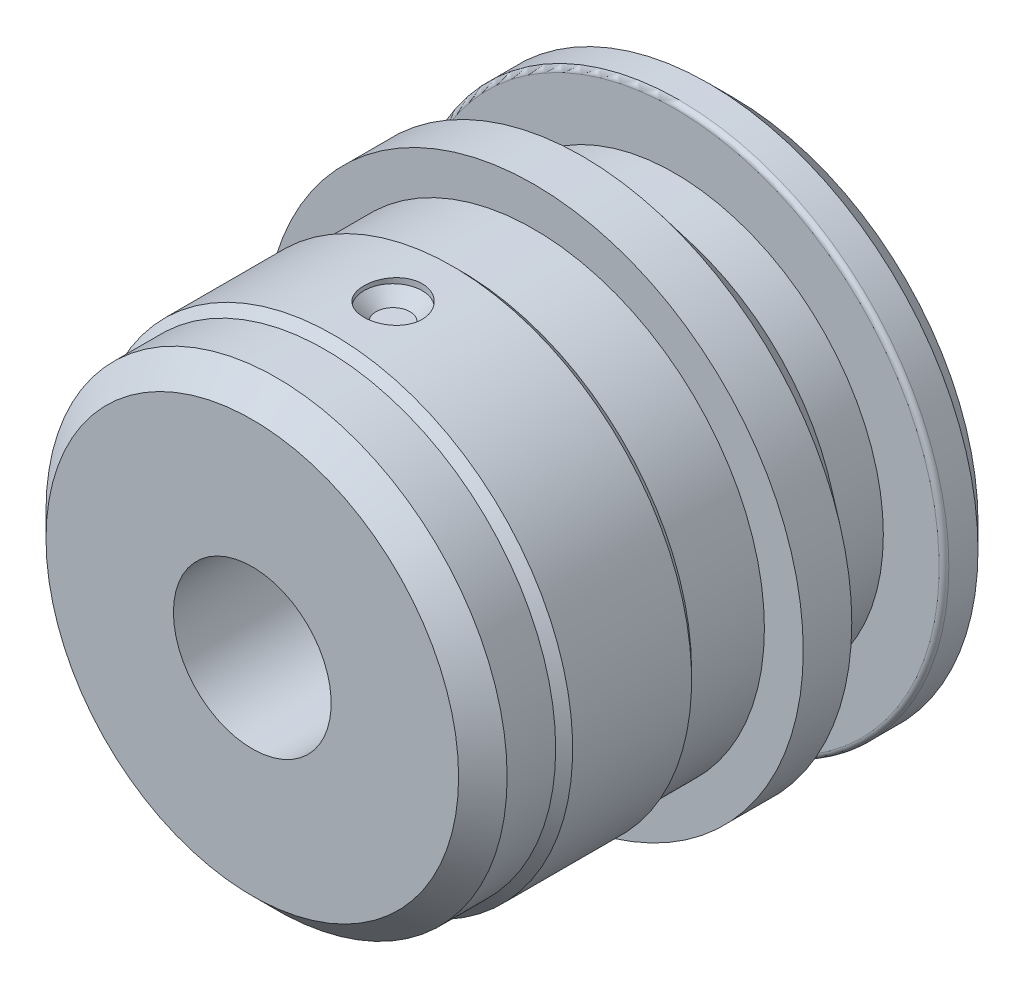
from build123d import *

# Parameters (mm, degrees)
CHAMFER_1_SIZE                       = 1
CHAMFER_2_SIZE                       = 1
FILLET_1_R                           = 0.2
SKETCH_5_R                           = 1.2
CUT_EXTRUDE_2_DEPTH                  = 2
CHAMFER_3_SIZE                       = 0.5
PATTERN_CIRCULAR_1_COUNT             = 2
CHAMFER_3_OF_PATTERN_CIRCULAR_1_SIZE = 0.5


with BuildPart() as part:
    # 스케치3 → 회전2 (revolve)
    with BuildSketch(Plane(origin=(0, 0, 0), x_dir=(1, 0, 0), z_dir=(0, 1, 0)), mode=Mode.PRIVATE) as revolve_2_sk:
        Polygon((11.1, 0), (11.1, -2.4), (8.6, -2.4), (8.6, -4.2), (11.1, -6.2), (11.1, -8.2), (9.5, -8.2), (9.5, -11.2), (9.85, -11.55), (9.85, -16.45), (9.5, -16.8), (9.5, -19.8), (3.25, -19.8), (3.25, -11.8), (4.4, -11.8), (4.4, -10), (3.4, -10), (3.4, -8.5), (6.1, -7.77653718), (6.1, 0), align=None)
    revolve(revolve_2_sk.sketch.rotate(Axis((0, 0, 0), (0, 0, 1)), 180), axis=Axis((0, 0, 0), (0, 0, 1)))

    # 모따기1
    chamfer_1_edges = [part.edges().sort_by_distance(p)[0] for p in [
        (9.5, 0, 19.8),
        (6.1, 0, 0),
    ]]
    chamfer(chamfer_1_edges, length=CHAMFER_1_SIZE)

    # 모따기2
    chamfer_2_edges = [part.edges().sort_by_distance(p)[0] for p in [
        (11.1, 0, 0),
    ]]
    chamfer(chamfer_2_edges, length=CHAMFER_2_SIZE)

    # 필렛1
    fillet_1_edges = [part.edges().sort_by_distance(p)[0] for p in [
        (11.1, 0, 2.4),
    ]]
    fillet(fillet_1_edges, radius=FILLET_1_R)

    # 스케치5 → 컷-돌출2 (cut)
    with BuildSketch(Plane(origin=(0, 11.1, 0), x_dir=(1, 0, 0), z_dir=(0, 1, 0))):
        with Locations(Location((0, -14, 0), (0, 0, 270))):
            Circle(SKETCH_5_R)
    cut_extrude_2 = extrude(amount=-CUT_EXTRUDE_2_DEPTH, mode=Mode.SUBTRACT)

    # 모따기3
    chamfer_3_edges = [part.edges().sort_by_distance(p)[0] for p in [
        (0, 9.1, 12.8),
    ]]
    chamfer(chamfer_3_edges, length=CHAMFER_3_SIZE)

    # 원형 패턴1: 컷-돌출2 ×2 about axis
    pattern_circular_1_axis = Axis((0, 0, 0), (0, 0, -1))
    for i in range(1, PATTERN_CIRCULAR_1_COUNT):
        add(cut_extrude_2.rotate(pattern_circular_1_axis, i * 360 / PATTERN_CIRCULAR_1_COUNT), mode=Mode.SUBTRACT)

    # 모따기3 of 원형 패턴1
    chamfer_3_of_pattern_circular_1_edges = [part.edges().sort_by_distance(p)[0] for p in [
        (0, -9.1, 12.8),
    ]]
    chamfer(chamfer_3_of_pattern_circular_1_edges, length=CHAMFER_3_OF_PATTERN_CIRCULAR_1_SIZE)


solid = part.part
